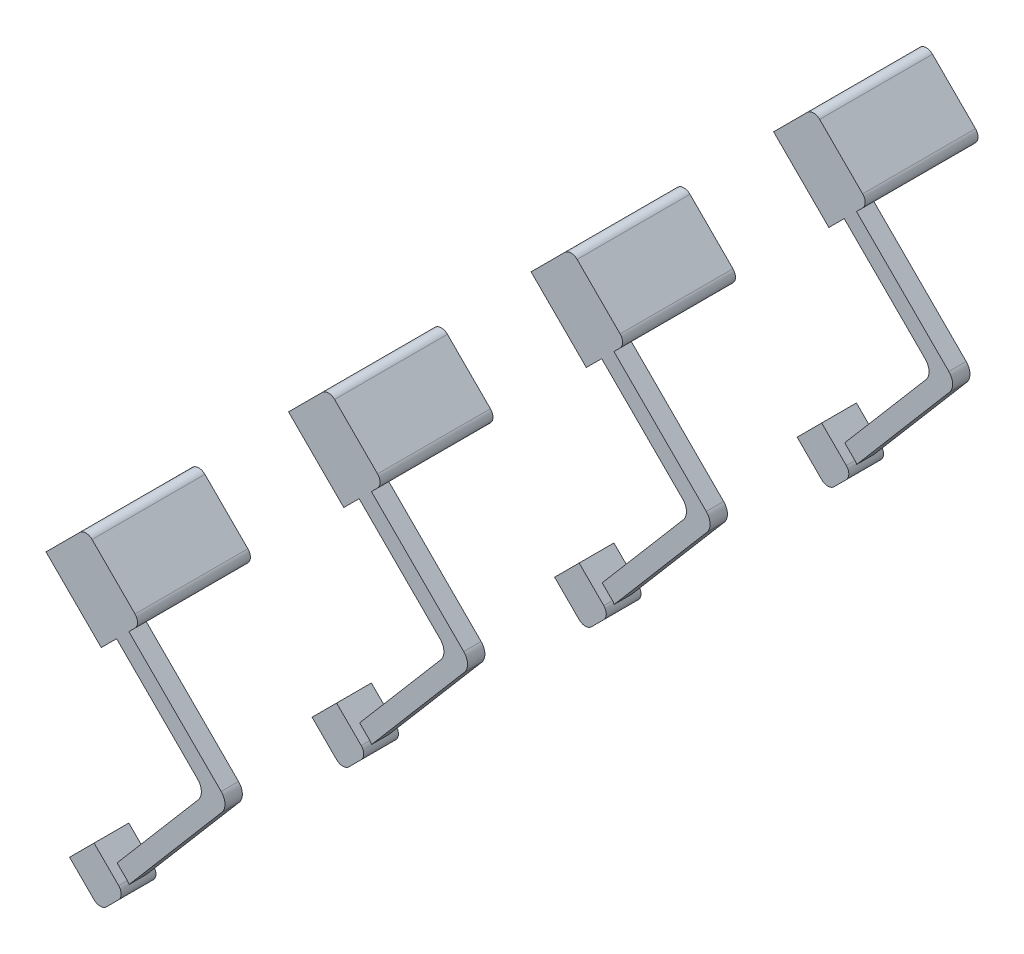
from build123d import *

# Parameters (mm, degrees)
COIL_START        = -4.1
COIL_1_DEPTH      = 52
PLUG_START        = 39.9
PLUG_LEAD_1_DEPTH = 8
PLUG_START_2      = 35.9
PLUG_BOOT_1_DEPTH = 16
COIL_START_2      = -115.86
COIL_3_DEPTH      = 52
PLUG_START_3      = -71.86
PLUG_LEAD_3_DEPTH = 8
PLUG_START_4      = -75.86
PLUG_BOOT_3_DEPTH = 16
COIL_START_3      = -227.62
COIL_5_DEPTH      = 52
PLUG_START_5      = -183.62
PLUG_LEAD_5_DEPTH = 8
PLUG_START_6      = -187.62
PLUG_BOOT_5_DEPTH = 16
COIL_START_4      = -339.38
COIL_7_DEPTH      = 52
PLUG_START_7      = -295.38
PLUG_LEAD_7_DEPTH = 8
PLUG_START_8      = -299.38
PLUG_BOOT_7_DEPTH = 16


with BuildPart() as part:
    # Sketch1 → Coil 1 (new body)
    with BuildSketch(Plane.XY.offset(COIL_START)):
        with BuildLine():
            Line((261.5941537, 287.049997823), (287.049997823, 261.5941537))
            Line((287.049997823, 261.5941537), (302.606347009, 277.150502886))
            ThreePointArc((302.606347009, 277.150502886), (303.777919884, 279.978930011), (302.606347009, 282.807357136))
            Line((302.606347009, 282.807357136), (282.807357136, 302.606347009))
            ThreePointArc((282.807357136, 302.606347009), (279.978930011, 303.777919884), (277.150502886, 302.606347009))
            Line((277.150502886, 302.606347009), (261.5941537, 287.049997823))
        make_face()
    extrude(amount=COIL_1_DEPTH)

    # Sketch2 → Plug Lead 1 (add)
    with BuildSketch(Plane.XY.offset(PLUG_START)):
        with BuildLine():
            Line((288.464211385, 274.322075761), (331.433712353, 231.352574794))
            ThreePointArc((331.433712353, 231.352574794), (333.18629268, 227.349360476), (331.758531048, 223.219135373))
            Line((331.758531048, 223.219135373), (288.954772369, 172.971244749))
            Line((288.954772369, 172.971244749), (295.044718213, 167.783513104))
            Line((295.044718213, 167.783513104), (342.63776427, 223.65361065))
            ThreePointArc((342.63776427, 223.65361065), (344.065525902, 227.783835753), (342.312945575, 231.787050071))
            Line((342.312945575, 231.787050071), (294.121065635, 279.978930011))
            Line((294.121065635, 279.978930011), (288.464211385, 274.322075761))
        make_face()
    extrude(amount=PLUG_LEAD_1_DEPTH)

    # Sketch3 → Plug Boot 1 (add)
    with BuildSketch(Plane.XY.offset(PLUG_START_2)):
        with BuildLine():
            Line((276.443396105, 174.620019614), (287.757104604, 163.306311115))
            ThreePointArc((287.757104604, 163.306311115), (290.585531729, 162.13473824), (293.413958853, 163.306311115))
            Line((293.413958853, 163.306311115), (299.070813103, 168.963165365))
            ThreePointArc((299.070813103, 168.963165365), (300.242385978, 171.791592489), (299.070813103, 174.620019614))
            Line((299.070813103, 174.620019614), (287.757104604, 185.933728113))
            Line((287.757104604, 185.933728113), (276.443396105, 174.620019614))
        make_face()
    extrude(amount=PLUG_BOOT_1_DEPTH)


with BuildPart() as body_2:
    # Sketch4 → Coil 3 (new body)
    with BuildSketch(Plane.XY.offset(COIL_START_2)):
        with BuildLine():
            Line((261.5941537, 287.049997823), (287.049997823, 261.5941537))
            Line((287.049997823, 261.5941537), (302.606347009, 277.150502886))
            ThreePointArc((302.606347009, 277.150502886), (303.777919884, 279.978930011), (302.606347009, 282.807357136))
            Line((302.606347009, 282.807357136), (282.807357136, 302.606347009))
            ThreePointArc((282.807357136, 302.606347009), (279.978930011, 303.777919884), (277.150502886, 302.606347009))
            Line((277.150502886, 302.606347009), (261.5941537, 287.049997823))
        make_face()
    extrude(amount=COIL_3_DEPTH)

    # Sketch5 → Plug Lead 3 (add)
    with BuildSketch(Plane.XY.offset(PLUG_START_3)):
        with BuildLine():
            Line((288.464211385, 274.322075761), (331.433712353, 231.352574794))
            ThreePointArc((331.433712353, 231.352574794), (333.18629268, 227.349360476), (331.758531048, 223.219135373))
            Line((331.758531048, 223.219135373), (288.954772369, 172.971244749))
            Line((288.954772369, 172.971244749), (295.044718213, 167.783513104))
            Line((295.044718213, 167.783513104), (342.63776427, 223.65361065))
            ThreePointArc((342.63776427, 223.65361065), (344.065525902, 227.783835753), (342.312945575, 231.787050071))
            Line((342.312945575, 231.787050071), (294.121065635, 279.978930011))
            Line((294.121065635, 279.978930011), (288.464211385, 274.322075761))
        make_face()
    extrude(amount=PLUG_LEAD_3_DEPTH)

    # Sketch6 → Plug Boot 3 (add)
    with BuildSketch(Plane.XY.offset(PLUG_START_4)):
        with BuildLine():
            Line((276.443396105, 174.620019614), (287.757104604, 163.306311115))
            ThreePointArc((287.757104604, 163.306311115), (290.585531729, 162.13473824), (293.413958853, 163.306311115))
            Line((293.413958853, 163.306311115), (299.070813103, 168.963165365))
            ThreePointArc((299.070813103, 168.963165365), (300.242385978, 171.791592489), (299.070813103, 174.620019614))
            Line((299.070813103, 174.620019614), (287.757104604, 185.933728113))
            Line((287.757104604, 185.933728113), (276.443396105, 174.620019614))
        make_face()
    extrude(amount=PLUG_BOOT_3_DEPTH)


with BuildPart() as body_3:
    # Sketch7 → Coil 5 (new body)
    with BuildSketch(Plane.XY.offset(COIL_START_3)):
        with BuildLine():
            Line((261.5941537, 287.049997823), (287.049997823, 261.5941537))
            Line((287.049997823, 261.5941537), (302.606347009, 277.150502886))
            ThreePointArc((302.606347009, 277.150502886), (303.777919884, 279.978930011), (302.606347009, 282.807357136))
            Line((302.606347009, 282.807357136), (282.807357136, 302.606347009))
            ThreePointArc((282.807357136, 302.606347009), (279.978930011, 303.777919884), (277.150502886, 302.606347009))
            Line((277.150502886, 302.606347009), (261.5941537, 287.049997823))
        make_face()
    extrude(amount=COIL_5_DEPTH)

    # Sketch8 → Plug Lead 5 (add)
    with BuildSketch(Plane.XY.offset(PLUG_START_5)):
        with BuildLine():
            Line((288.464211385, 274.322075761), (331.433712353, 231.352574794))
            ThreePointArc((331.433712353, 231.352574794), (333.18629268, 227.349360476), (331.758531048, 223.219135373))
            Line((331.758531048, 223.219135373), (288.954772369, 172.971244749))
            Line((288.954772369, 172.971244749), (295.044718213, 167.783513104))
            Line((295.044718213, 167.783513104), (342.63776427, 223.65361065))
            ThreePointArc((342.63776427, 223.65361065), (344.065525902, 227.783835753), (342.312945575, 231.787050071))
            Line((342.312945575, 231.787050071), (294.121065635, 279.978930011))
            Line((294.121065635, 279.978930011), (288.464211385, 274.322075761))
        make_face()
    extrude(amount=PLUG_LEAD_5_DEPTH)

    # Sketch9 → Plug Boot 5 (add)
    with BuildSketch(Plane.XY.offset(PLUG_START_6)):
        with BuildLine():
            Line((276.443396105, 174.620019614), (287.757104604, 163.306311115))
            ThreePointArc((287.757104604, 163.306311115), (290.585531729, 162.13473824), (293.413958853, 163.306311115))
            Line((293.413958853, 163.306311115), (299.070813103, 168.963165365))
            ThreePointArc((299.070813103, 168.963165365), (300.242385978, 171.791592489), (299.070813103, 174.620019614))
            Line((299.070813103, 174.620019614), (287.757104604, 185.933728113))
            Line((287.757104604, 185.933728113), (276.443396105, 174.620019614))
        make_face()
    extrude(amount=PLUG_BOOT_5_DEPTH)


with BuildPart() as body_4:
    # Sketch10 → Coil 7 (new body)
    with BuildSketch(Plane.XY.offset(COIL_START_4)):
        with BuildLine():
            Line((261.5941537, 287.049997823), (287.049997823, 261.5941537))
            Line((287.049997823, 261.5941537), (302.606347009, 277.150502886))
            ThreePointArc((302.606347009, 277.150502886), (303.777919884, 279.978930011), (302.606347009, 282.807357136))
            Line((302.606347009, 282.807357136), (282.807357136, 302.606347009))
            ThreePointArc((282.807357136, 302.606347009), (279.978930011, 303.777919884), (277.150502886, 302.606347009))
            Line((277.150502886, 302.606347009), (261.5941537, 287.049997823))
        make_face()
    extrude(amount=COIL_7_DEPTH)

    # Sketch11 → Plug Lead 7 (add)
    with BuildSketch(Plane.XY.offset(PLUG_START_7)):
        with BuildLine():
            Line((288.464211385, 274.322075761), (331.433712353, 231.352574794))
            ThreePointArc((331.433712353, 231.352574794), (333.18629268, 227.349360476), (331.758531048, 223.219135373))
            Line((331.758531048, 223.219135373), (288.954772369, 172.971244749))
            Line((288.954772369, 172.971244749), (295.044718213, 167.783513104))
            Line((295.044718213, 167.783513104), (342.63776427, 223.65361065))
            ThreePointArc((342.63776427, 223.65361065), (344.065525902, 227.783835753), (342.312945575, 231.787050071))
            Line((342.312945575, 231.787050071), (294.121065635, 279.978930011))
            Line((294.121065635, 279.978930011), (288.464211385, 274.322075761))
        make_face()
    extrude(amount=PLUG_LEAD_7_DEPTH)

    # Sketch12 → Plug Boot 7 (add)
    with BuildSketch(Plane.XY.offset(PLUG_START_8)):
        with BuildLine():
            Line((276.443396105, 174.620019614), (287.757104604, 163.306311115))
            ThreePointArc((287.757104604, 163.306311115), (290.585531729, 162.13473824), (293.413958853, 163.306311115))
            Line((293.413958853, 163.306311115), (299.070813103, 168.963165365))
            ThreePointArc((299.070813103, 168.963165365), (300.242385978, 171.791592489), (299.070813103, 174.620019614))
            Line((299.070813103, 174.620019614), (287.757104604, 185.933728113))
            Line((287.757104604, 185.933728113), (276.443396105, 174.620019614))
        make_face()
    extrude(amount=PLUG_BOOT_7_DEPTH)


solid = Compound([part.part, body_2.part, body_3.part, body_4.part])
